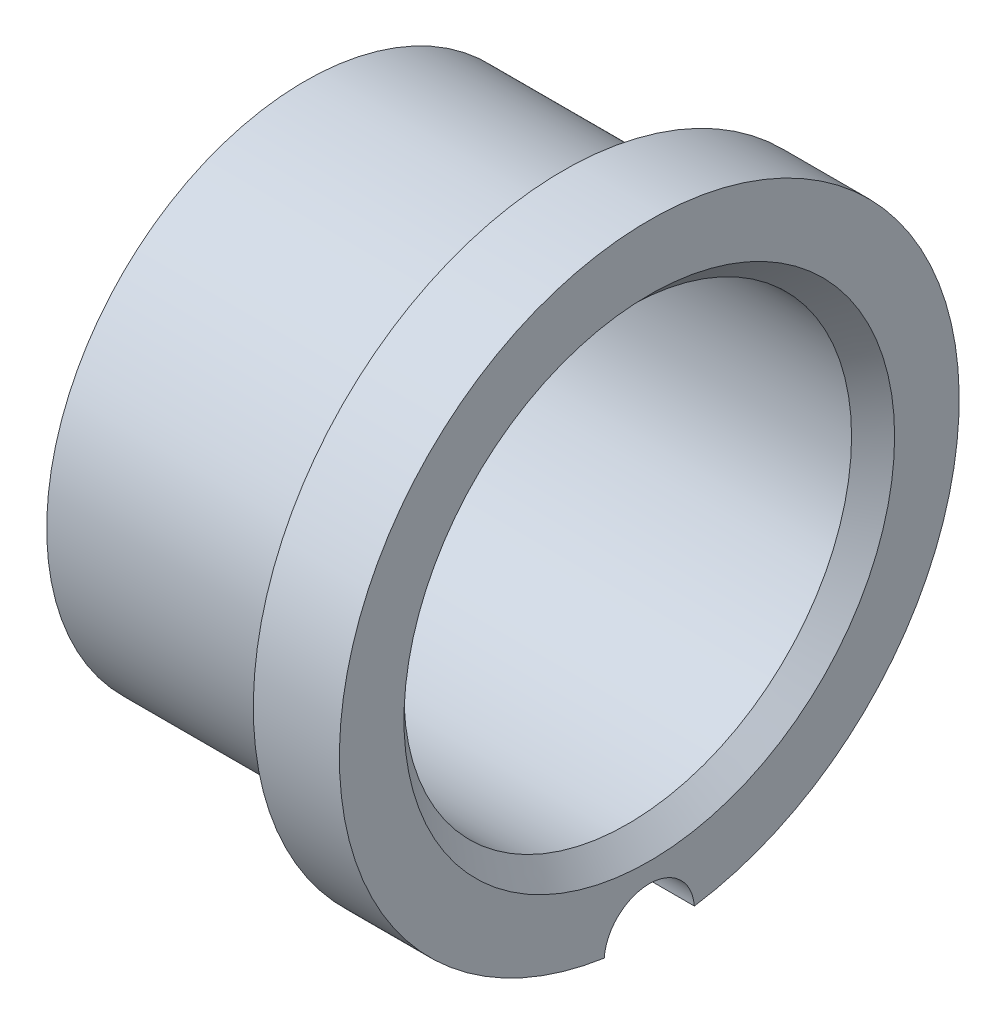
from build123d import *

# Parameters (mm, degrees)
SKETCH2_R             = 30
BOSS_EXTRUDE1_DEPTH   = 30
SKETCH3_R             = 36
BOSS_EXTRUDE2_DEPTH   = 10
SKETCH4_R             = 26
CUT_EXTRUDE1_DEPTH    = 65.745656225
CHAMFER1_SIZE         = 2.5
D_GAGEMENT_M101_D     = 10.5
D_GAGEMENT_M101_DEPTH = 20
D_GAGEMENT_M101_TIP   = 3.15451825


with BuildPart() as part:
    # Sketch2 → Boss-Extrude1 (new body)
    with BuildSketch(Plane(origin=(0, 0, 0), x_dir=(0, 0, -1), z_dir=(1, 0, 0))):
        Circle(SKETCH2_R)
    extrude(amount=BOSS_EXTRUDE1_DEPTH)

    # Sketch3 → Boss-Extrude2 (add)
    with BuildSketch(Plane(origin=(30, 0, 0), x_dir=(0, 0, -1), z_dir=(1, 0, 0))):
        Circle(SKETCH3_R)
    extrude(amount=BOSS_EXTRUDE2_DEPTH)

    # Sketch4 → Cut-Extrude1 (cut, through all)
    with BuildSketch(Plane(origin=(40, 0, 0), x_dir=(0, 0, -1), z_dir=(1, 0, 0))):
        Circle(SKETCH4_R)
    extrude(amount=-CUT_EXTRUDE1_DEPTH, mode=Mode.SUBTRACT)

    # Chamfer1
    chamfer1_edges = [part.edges().sort_by_distance(p)[0] for p in [
        (40, 0, 26),
    ]]
    chamfer(chamfer1_edges, length=CHAMFER1_SIZE)

    # Dégagement M101
    with Locations(Plane(origin=(40, 0, 0), x_dir=(0, 0, -1), z_dir=(1, 0, 0))):
        with Locations((0, -36)):
            Hole(D_GAGEMENT_M101_D / 2, depth=D_GAGEMENT_M101_DEPTH)
            with Locations((0, 0, -(D_GAGEMENT_M101_DEPTH + D_GAGEMENT_M101_TIP / 2))):  # 118° drill point
                Cone(0, D_GAGEMENT_M101_D / 2, D_GAGEMENT_M101_TIP, mode=Mode.SUBTRACT)


solid = part.part
